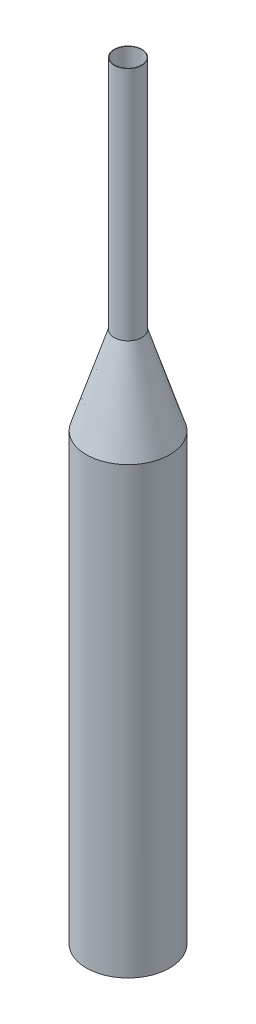
from build123d import *

# Parameters (mm, degrees)
SKETCH1_R           = 314.325
SKETCH1_R_2         = 311.15
BOSS_EXTRUDE1_DEPTH = 3352.8


with BuildPart() as part:
    # Sketch1 → Boss-Extrude1 (new body)
    with BuildSketch(Plane(origin=(0, 0, 0), x_dir=(1, 0, 0), z_dir=(0, 1, 0))):
        with Locations(Location((0, 0, 0), (0, 0, 270))):
            Circle(SKETCH1_R)
        with Locations(Location((0, 0, 0), (0, 0, 270))):
            Circle(SKETCH1_R_2, mode=Mode.SUBTRACT)
    extrude(amount=BOSS_EXTRUDE1_DEPTH)

    # Sketch2 → Revolve1 (revolve)
    with BuildSketch(Plane.XY, mode=Mode.PRIVATE) as revolve1_sk:
        Polygon((-314.325, 3352.8), (-104.626105977, 4013.2), (-104.626105977, 5791.2), (-101.6, 5791.2), (-101.6, 4012.73109141), (-311.15, 3352.8), align=None)
    revolve(revolve1_sk.sketch.rotate(Axis((0, 3352.8, 0), (0, 1, 0)), 270), axis=Axis((0, 3352.8, 0), (0, 1, 0)))


solid = part.part
